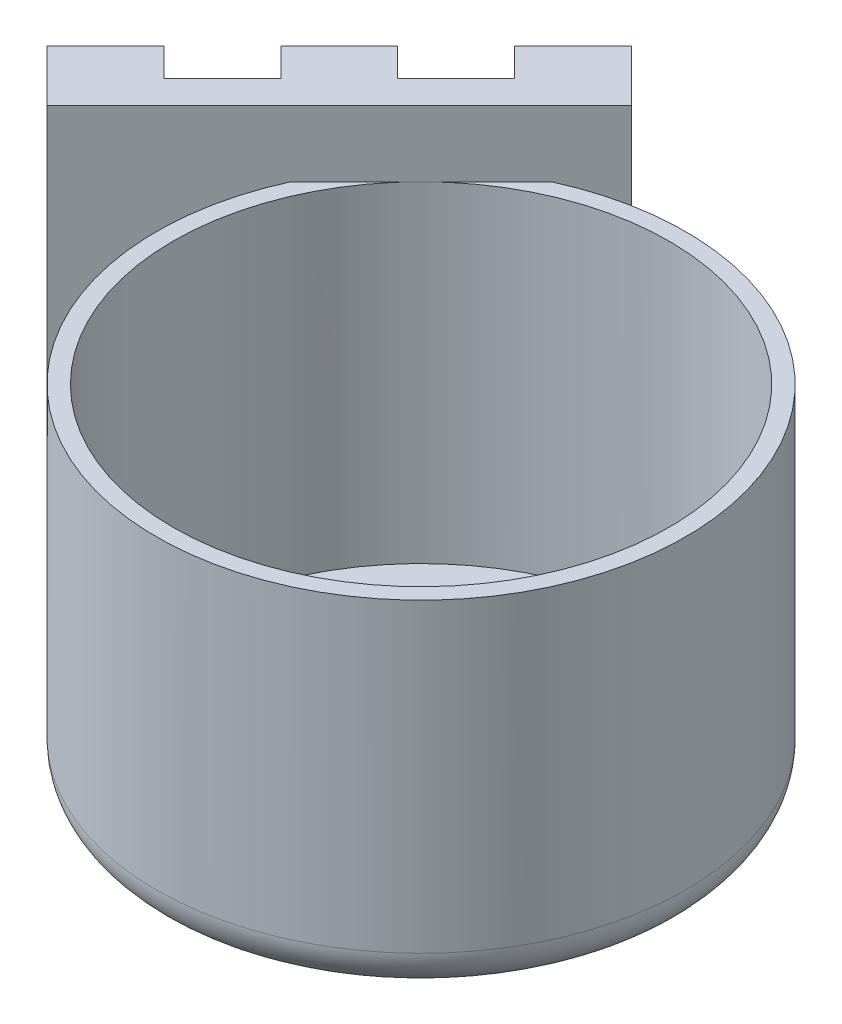
from build123d import *

# Parameters (mm, degrees)
SKETCH1_R           = 40.64
BOSS_EXTRUDE1_DEPTH = 53.34
FILLET1_R           = 6.35
SKETCH2_R           = 38.1
CUT_EXTRUDE1_DEPTH  = 50.8
SKETCH7_W           = 5.08
SKETCH7_H           = 57.15
BOSS_EXTRUDE3_DEPTH = 63.5
SKETCH8_W           = 12.7
SKETCH8_H           = 6.35
BOSS_EXTRUDE4_DEPTH = 6.096


with BuildPart() as part:
    # Sketch1 → Boss-Extrude1 (new body)
    with BuildSketch(Plane(origin=(0, 0, 0), x_dir=(1, 0, 0), z_dir=(0, 1, 0))):
        with Locations(Location((0, 0, 0), (0, 0, 270))):
            Circle(SKETCH1_R)
    extrude(amount=BOSS_EXTRUDE1_DEPTH)

    # Fillet1
    fillet1_edges = [part.edges().sort_by_distance(p)[0] for p in [
        (0, 0, -40.64),
    ]]
    fillet(fillet1_edges, radius=FILLET1_R)

    # Sketch2 → Cut-Extrude1 (cut)
    with BuildSketch(Plane(origin=(0, 53.34, 0), x_dir=(1, 0, 0), z_dir=(0, 1, 0))):
        with Locations(Location((0, 0, 0), (0, 0, 270))):
            Circle(SKETCH2_R)
    extrude(amount=-CUT_EXTRUDE1_DEPTH, mode=Mode.SUBTRACT)



with BuildPart() as body_2:
    # Sketch7 → Boss-Extrude3 (new body)
    with BuildSketch(Plane(origin=(-28.736819587, 0, 28.736819587), x_dir=(0.7071067811865477, 0, 0.7071067811865475), z_dir=(-0.7071067811865475, 0, 0.7071067811865477))):
        with Locations((-40.64, 34.925)):
            Rectangle(SKETCH7_W, SKETCH7_H)
    extrude(amount=-BOSS_EXTRUDE3_DEPTH)


with BuildPart() as part_1:
    add(part.part)

    add(body_2.part)  # Boss-Extrude4 merges body 2
    # Sketch8 → Boss-Extrude4 (add)
    with BuildSketch(Plane(origin=(-30.532870812, 0, -30.532870812), x_dir=(-0.7071067811865474, 0, 0.7071067811865477), z_dir=(-0.7071067811865477, 0, -0.7071067811865474))):
        with Locations((34.29, 60.325)):
            Rectangle(SKETCH8_W, SKETCH8_H)
        with Locations((34.29, 34.925)):
            Rectangle(SKETCH8_W, SKETCH8_H)
        with Locations((8.89, 60.325)):
            Rectangle(SKETCH8_W, SKETCH8_H)
        with Locations((34.29, 9.525)):
            Rectangle(SKETCH8_W, SKETCH8_H)
        with Locations((8.89, 34.925)):
            Rectangle(SKETCH8_W, SKETCH8_H)
        with Locations((8.89, 9.525)):
            Rectangle(SKETCH8_W, SKETCH8_H)
        with Locations((-16.51, 60.325)):
            Rectangle(SKETCH8_W, SKETCH8_H)
        with Locations((-16.51, 34.925)):
            Rectangle(SKETCH8_W, SKETCH8_H)
        with Locations((-16.51, 9.525)):
            Rectangle(SKETCH8_W, SKETCH8_H)
    extrude(amount=BOSS_EXTRUDE4_DEPTH)


solid = part_1.part
